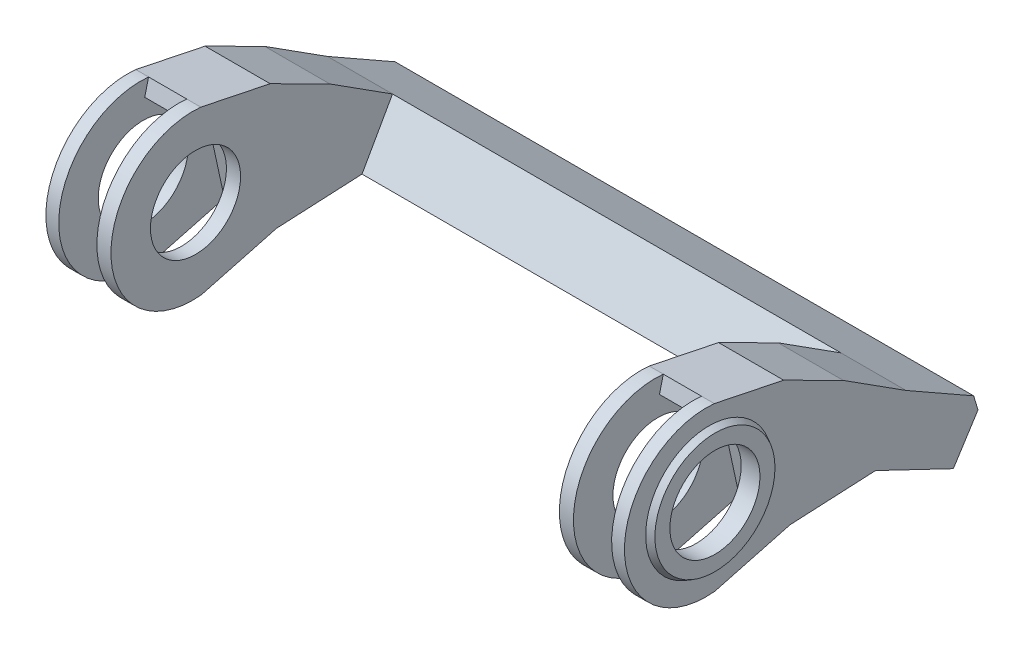
from build123d import *

# Parameters (mm, degrees)
BOSS_EXTRUDE1_DEPTH      = 110.9489018
BOSS_EXTRUDE1_DEPTH_BACK = 110.9489018
BOSS_EXTRUDE2_DEPTH      = 32.209994
CUT_EXTRUDE1_DEPTH       = 18.876772
CUT_EXTRUDE2_DEPTH       = 416.307857918
CUT_EXTRUDE2_DEPTH_BACK  = 416.307857918
SKETCH5_R                = 22.292778643


with BuildPart() as part:
    # Sketch1 → Boss-Extrude1 (new, two sides: drawn at the far end of the back side and taken through both)
    with BuildSketch(Plane(origin=(0, 0, 0), x_dir=(0, 0, -1), z_dir=(1, 0, 0)).offset(-BOSS_EXTRUDE1_DEPTH_BACK)):
        Polygon((6.83514, 301.821342), (21.92401, 328.61631), (55.395622, 309.582058), (57.54243, 302.475138), (45.347128, 283.376878), align=None)
    extrude(amount=BOSS_EXTRUDE1_DEPTH + BOSS_EXTRUDE1_DEPTH_BACK)

    # Sketch2 → Boss-Extrude2 (add)
    with BuildSketch(Plane(origin=(110.9489018, 0, 0), x_dir=(0, 0, -1), z_dir=(1, 0, 0))):
        with BuildLine():
            Line((6.83514, 301.821342), (45.347128, 283.376878))
            Line((45.347128, 283.376878), (57.54243, 302.475138))
            Line((57.54243, 302.475138), (55.395622, 309.582058))
            Line((55.395622, 309.582058), (21.92401, 328.61631))
            Line((21.92401, 328.61631), (-9.123759242, 348.442038748))
            Line((-9.123759242, 348.442038748), (-38.632384, 363.30001))
            Line((-38.632384, 363.30001), (-72.944482, 370.416836))
            ThreePointArc((-72.944482, 370.416836), (-117.407477991, 329.968892479), (-72.634094, 289.8648))
            Line((-72.634094, 289.8648), (-35.4457, 299.743114))
            Line((-35.4457, 299.743114), (6.83514, 301.821342))
        make_face()
    boss_extrude2 = extrude(amount=BOSS_EXTRUDE2_DEPTH)

    # Sketch3 → Cut-Extrude1 (cut)
    with BuildSketch(Plane(origin=(117.9218622, 0, 0), x_dir=(0, 0, -1), z_dir=(1, 0, 0))):
        with BuildLine():
            Line((-72.944482, 370.416836), (-74.851006, 362.67771))
            ThreePointArc((-74.851006, 362.67771), (-56.970321512, 357.844301113), (-44.98594, 343.721436))
            Line((-44.98594, 343.721436), (-35.4457, 299.743114))
            Line((-35.4457, 299.743114), (-71.143283627, 263.85225615))
            Line((-71.143283627, 263.85225615), (-147.020328304, 329.117126747))
            Line((-147.020328304, 329.117126747), (-87.829159197, 385.301513197))
            Line((-87.829159197, 385.301513197), (-72.944482, 370.416836))
        make_face()
    cut_extrude1 = extrude(amount=CUT_EXTRUDE1_DEPTH, mode=Mode.SUBTRACT)

    # Sketch4 → Revolve1 (revolve)
    with BuildSketch(Plane.XY.offset(75.57643), mode=Mode.PRIVATE) as revolve1_sk:
        Polygon((141.481302, 363.150404), (146.090386, 360.588814), (146.090386, 330.870306), (141.481302, 330.870306), align=None)
    revolve1 = revolve(revolve1_sk.sketch.rotate(Axis((146.090386, 330.870306, 75.57643), (-1, 0, 0)), 90), axis=Axis((146.090386, 330.870306, 75.57643), (-1, 0, 0)))

    # Mirror1: Boss-Extrude2, Cut-Extrude1, Revolve1 across plane
    add(boss_extrude2.mirror(Plane(origin=(0, 0, 0), x_dir=(0, 0, 1), z_dir=(1, 0, 0))))
    add(cut_extrude1.mirror(Plane(origin=(0, 0, 0), x_dir=(0, 0, 1), z_dir=(1, 0, 0))), mode=Mode.SUBTRACT)
    add(revolve1.mirror(Plane(origin=(0, 0, 0), x_dir=(0, 0, 1), z_dir=(1, 0, 0))))

    # Sketch5 → Cut-Extrude2 (cut, two sides: drawn at the far end of the back side and taken through both)
    with BuildSketch(Plane(origin=(0, 0, 0), x_dir=(0, 0, -1), z_dir=(1, 0, 0)).offset(-CUT_EXTRUDE2_DEPTH_BACK)):
        with Locations((-75.57643, 330.870306)):
            Circle(SKETCH5_R)
    extrude(amount=CUT_EXTRUDE2_DEPTH + CUT_EXTRUDE2_DEPTH_BACK, mode=Mode.SUBTRACT)


solid = part.part
